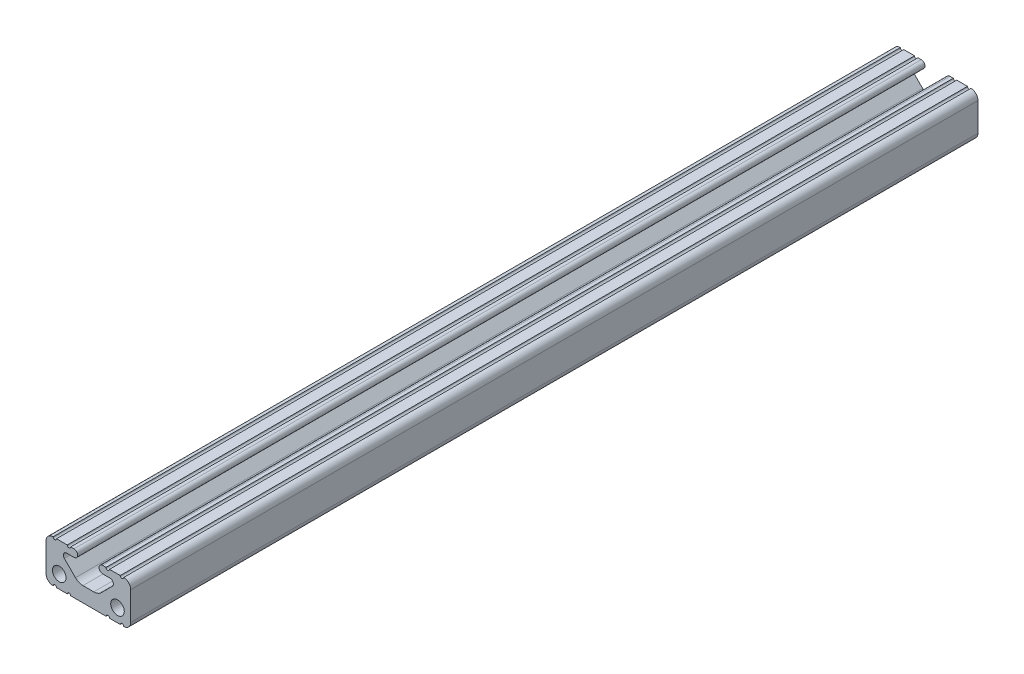
from build123d import *

# Parameters (mm, degrees)
SKETCH1_R           = 2.032
BOSS_EXTRUDE1_DEPTH = 127


with BuildPart() as part:
    # Sketch1 → Boss-Extrude1 (new, symmetric)
    with BuildSketch(Plane.XY):
        with BuildLine():
            Line((-12.7, 10.591838253), (-12.7, 2.108161747))
            ThreePointArc((-12.7, 2.108161747), (-12.078025605, 0.612955845), (-10.5791, 0))
            ThreePointArc((-10.5791, 0), (-10.06475, 0.508039196), (-9.5504, 0))
            Line((-9.5504, 0), (-6.3246, 0))
            ThreePointArc((-6.3246, 0), (-5.8166, 0.508), (-5.3086, 0))
            Line((-5.3086, 0), (5.3086, 0))
            ThreePointArc((5.3086, 0), (5.8166, 0.508), (6.3246, 0))
            Line((6.3246, 0), (9.5504, 0))
            ThreePointArc((9.5504, 0), (10.06475, 0.508039196), (10.5791, 0))
            ThreePointArc((10.5791, 0), (12.078025605, 0.612955845), (12.7, 2.108161747))
            Line((12.7, 2.108161747), (12.7, 10.591838253))
            ThreePointArc((12.7, 10.591838253), (12.078025605, 12.087044155), (10.5791, 12.7))
            ThreePointArc((10.5791, 12.7), (10.06475, 12.191960804), (9.5504, 12.7))
            Line((9.5504, 12.7), (6.3246, 12.7))
            ThreePointArc((6.3246, 12.7), (5.816599999, 12.191999983), (5.3086, 12.700000002))
            Line((5.3086, 12.700000002), (4.302307889, 12.700000002))
            ThreePointArc((4.302307889, 12.700000002), (3.197407889, 11.595100002), (4.302307889, 10.490200002))
            Line((4.302307889, 10.490200002), (6.487959021, 10.490200002))
            ThreePointArc((6.487959021, 10.490200002), (7.426620626, 9.863006369), (7.20637951, 8.755779512))
            Line((7.20637951, 8.755779512), (3.87633597, 5.425735971))
            ThreePointArc((3.87633597, 5.425735971), (2.846291837, 4.737482486), (1.631271939, 4.495800002))
            Line((1.631271939, 4.495800002), (-1.631271939, 4.495800002))
            ThreePointArc((-1.631271939, 4.495800002), (-2.846291837, 4.737482486), (-3.87633597, 5.425735971))
            Line((-3.87633597, 5.425735971), (-7.20637951, 8.755779512))
            ThreePointArc((-7.20637951, 8.755779512), (-7.426620626, 9.863006369), (-6.487959021, 10.490200002))
            Line((-6.487959021, 10.490200002), (-4.302307889, 10.490200002))
            ThreePointArc((-4.302307889, 10.490200002), (-3.197407889, 11.595100002), (-4.302307889, 12.700000002))
            Line((-4.302307889, 12.700000002), (-5.3086, 12.700000002))
            ThreePointArc((-5.3086, 12.700000002), (-5.816599999, 12.191999985), (-6.3246, 12.7))
            Line((-6.3246, 12.7), (-9.5504, 12.7))
            ThreePointArc((-9.5504, 12.7), (-10.06475, 12.191960804), (-10.5791, 12.7))
            ThreePointArc((-10.5791, 12.7), (-12.078025605, 12.087044155), (-12.7, 10.591838253))
        make_face()
        with Locations((-8.73125, 3.9624)):
            Circle(SKETCH1_R, mode=Mode.SUBTRACT)
        with Locations((8.73125, 3.9624)):
            Circle(SKETCH1_R, mode=Mode.SUBTRACT)
    extrude(amount=BOSS_EXTRUDE1_DEPTH, both=True)


solid = part.part
